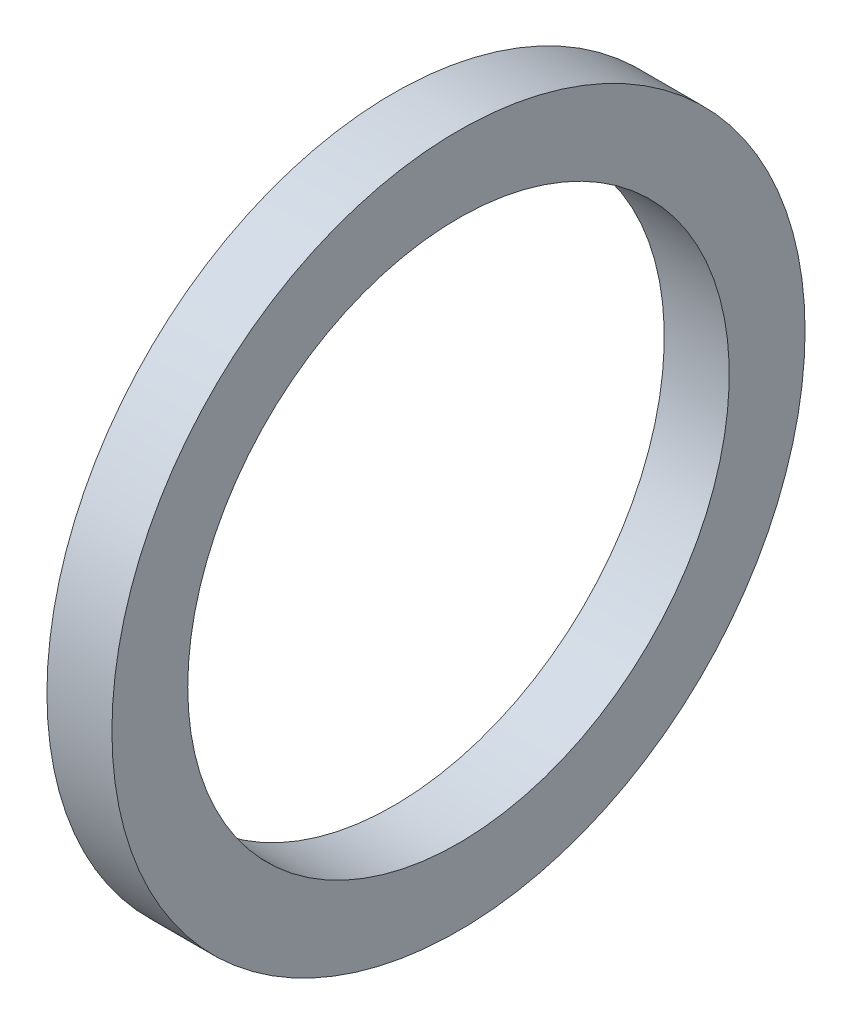
from build123d import *

# Parameters (mm, degrees)
ESQUISSE1_W = 3
ESQUISSE1_H = 3.5


with BuildPart() as part:
    # joint: sweep along a path in Esquisse3
    with BuildLine(Plane(origin=(0, 0, 0), x_dir=(0, 0, -1), z_dir=(1, 0, 0))) as joint_path:
        CenterArc((0, -12.5), 12.5, 0, 360)
    # Esquisse1 → joint (sweep)
    with BuildSketch(Plane.XY):
        with Locations((-1.5, 1.75)):
            Rectangle(ESQUISSE1_W, ESQUISSE1_H)
    sweep(path=joint_path.line)


solid = part.part
